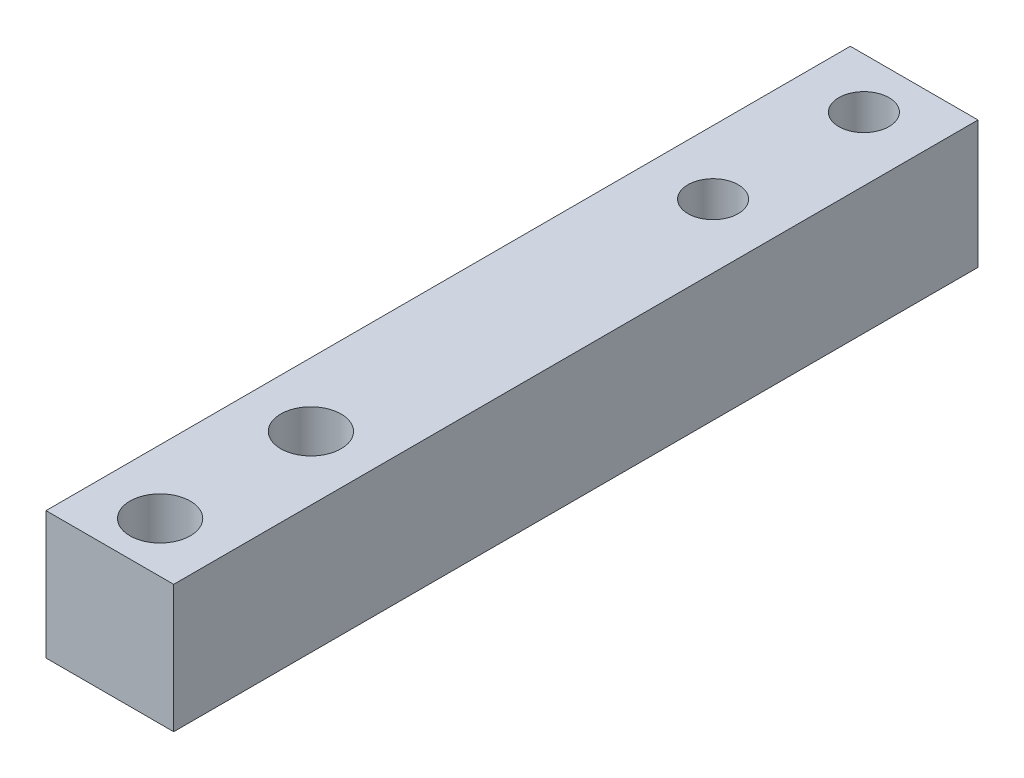
from build123d import *

# Parameters (mm, degrees)
SKETCH1_W           = 12.7
SKETCH1_H           = 80
BOSS_EXTRUDE1_DEPTH = 12.7
SKETCH2_R           = 2.5
SKETCH2_R_2         = 3
CUT_EXTRUDE1_DEPTH  = 12.7


with BuildPart() as part:
    # Sketch1 → Boss-Extrude1 (new body)
    with BuildSketch(Plane(origin=(0, 0, 0), x_dir=(1, 0, 0), z_dir=(0, 1, 0))):
        Rectangle(SKETCH1_W, SKETCH1_H)
    extrude(amount=BOSS_EXTRUDE1_DEPTH)

    # Sketch2 → Cut-Extrude1 (cut)
    with BuildSketch(Plane(origin=(0, 12.7, 0), x_dir=(1, 0, 0), z_dir=(0, 1, 0))):
        with Locations(Location((0, 35, 0), (0, 0, 270))):
            Circle(SKETCH2_R)
        with Locations(Location((0, 20, 0), (0, 0, 270))):
            Circle(SKETCH2_R)
        with Locations(Location((0, -20, 0), (0, 0, 270))):
            Circle(SKETCH2_R_2)
        with Locations(Location((0, -35, 0), (0, 0, 270))):
            Circle(SKETCH2_R_2)
    extrude(amount=-CUT_EXTRUDE1_DEPTH, mode=Mode.SUBTRACT)


solid = part.part
